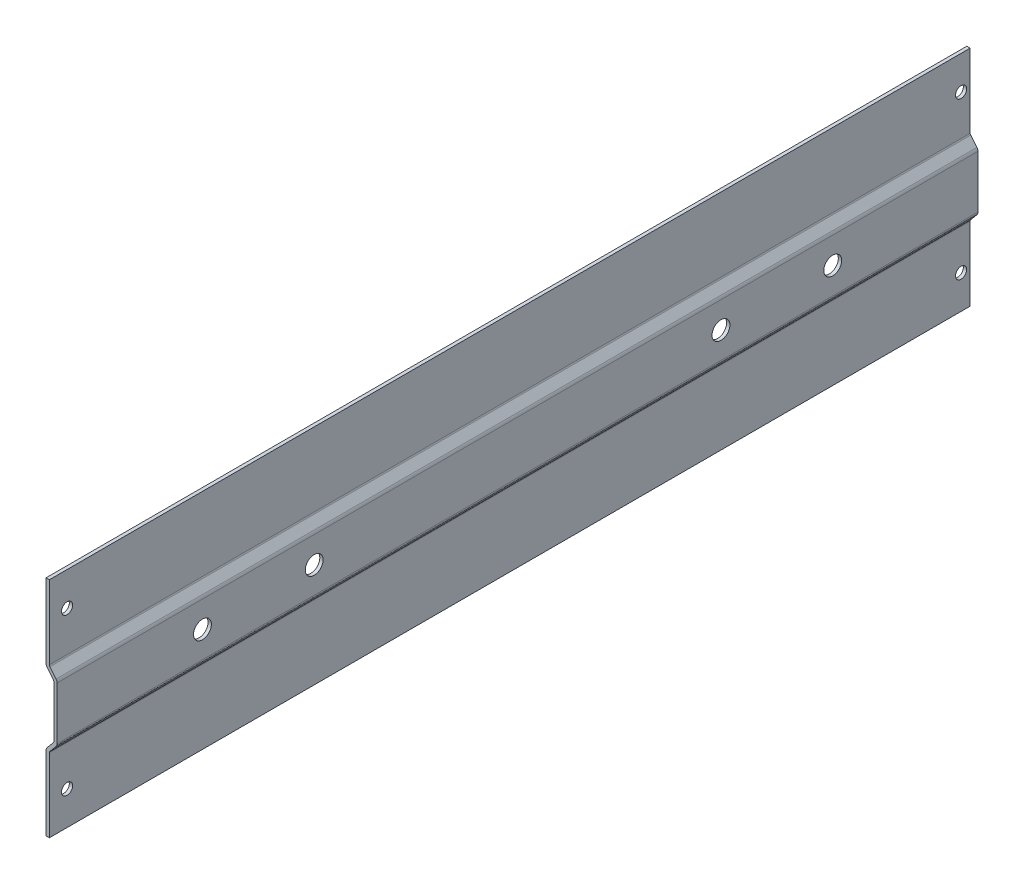
from build123d import *

# Parameters (mm, degrees)
EXTRUDE_1_DEPTH             = 824
FILLET_1_R                  = 4
FILLET_2_R                  = 2
HOLE_WIZARD_16_0_16_1_D     = 16
HOLE_WIZARD_16_0_16_1_DEPTH = 24.5
HOLE_WIZARD_16_0_16_1_TIP   = 4.806884952
HOLE_WIZARD_10_0_10_1_D     = 10


with BuildPart() as part:
    # 草图1 → 凸台-拉伸1 (new body)
    with BuildSketch(Plane.XY):
        Polygon((0, 0), (0, 67.749635555), (7, 76.091910703), (7, 123.908089297), (0, 132.250364445), (0, 200), (3, 200), (3, 133.342275148), (10, 125), (10, 75), (3, 66.657724852), (3, 0), align=None)
    extrude(amount=EXTRUDE_1_DEPTH)

    # 圆角1
    fillet_1_edges = [part.edges().sort_by_distance(p)[0] for p in [
        (0, 67.749635555, 412),
        (0, 132.250364445, 412),
        (10, 125, 412),
        (10, 75, 412),
    ]]
    fillet(fillet_1_edges, radius=FILLET_1_R)

    # 圆角2
    fillet_2_edges = [part.edges().sort_by_distance(p)[0] for p in [
        (7, 76.091910703, 412),
        (7, 123.908089297, 412),
        (3, 133.342275148, 412),
        (3, 66.657724852, 412),
    ]]
    fillet(fillet_2_edges, radius=FILLET_2_R)

    # Ø16.0 (16) 直径孔1
    with Locations(Plane(origin=(10, 0, 0), x_dir=(0, 0, -1), z_dir=(1, 0, 0))):
        with Locations((-694, 100), (-130, 100), (-594, 100), (-230, 100)):
            Hole(HOLE_WIZARD_16_0_16_1_D / 2, depth=HOLE_WIZARD_16_0_16_1_DEPTH)
            with Locations((0, 0, -(HOLE_WIZARD_16_0_16_1_DEPTH + HOLE_WIZARD_16_0_16_1_TIP / 2))):  # 118° drill point
                Cone(0, HOLE_WIZARD_16_0_16_1_D / 2, HOLE_WIZARD_16_0_16_1_TIP, mode=Mode.SUBTRACT)

    # Ø10.0 (10) 直径孔1 (through all)
    with Locations(Plane.ZY):
        with Locations((8.14, 170), (8.14, 30), (808.14, 170), (808.14, 30)):
            Hole(HOLE_WIZARD_10_0_10_1_D / 2)


solid = part.part
